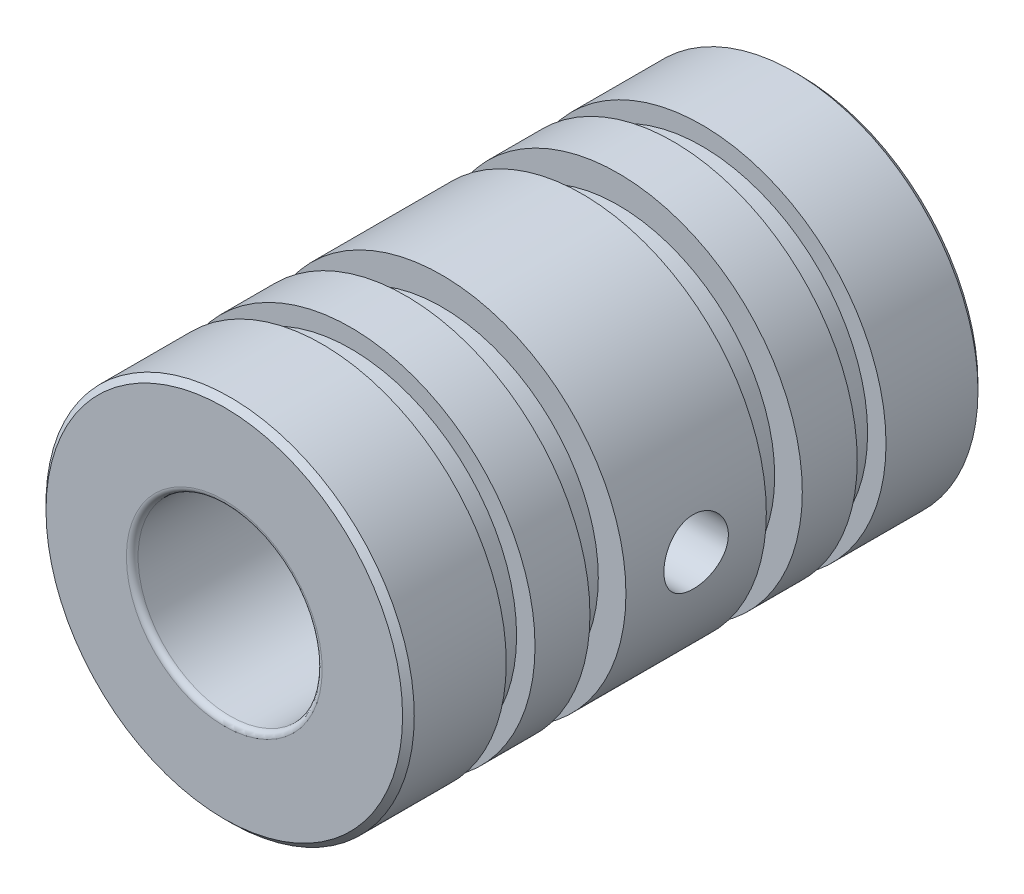
from build123d import *

# Parameters (mm, degrees)
BORE_DEPTH           = 17.8597153
BORE_DEPTH_BACK      = 17.8597153
SKETCH2_R            = 4
RETAINING_HOLE_2_R   = 1.4
RETAINING_HOLE_DEPTH = 17.8597153
ID_FILLET_R          = 0.254
OD_CHAMFER_SIZE      = 0.254
O_RINGS_2_W          = 1.5625
O_RINGS_2_H          = 1.2


with BuildPart() as part:
    # Sketch1 → Bearing (revolve)
    with BuildSketch(Plane(origin=(0, 0, 0), x_dir=(0, 0, -1), z_dir=(1, 0, 0))):
        Polygon((-12.5, 0), (12.5, 0), (12.5, -8), (8.25, -8), (8.25, -7.2), (7, -7.2), (7, -8), (-7, -8), (-7, -7.2), (-8.25, -7.2), (-8.25, -8), (-12.5, -8), align=None)
    revolve(axis=Axis((0, 0, 12.5), (0, 0, -1)))

    # Sketch2 → Bore (cut, two sides: drawn at the far end of the back side and taken through both)
    with BuildSketch(Plane.XY.offset(-BORE_DEPTH_BACK)):
        Circle(SKETCH2_R)
    extrude(amount=BORE_DEPTH + BORE_DEPTH_BACK, mode=Mode.SUBTRACT)

    # Retaining Hole 2 → Retaining Hole (cut, through all)
    with BuildSketch(Plane(origin=(0, 0, 0), x_dir=(0, 0, -1), z_dir=(1, 0, 0))):
        Circle(RETAINING_HOLE_2_R)
    extrude(amount=RETAINING_HOLE_DEPTH, mode=Mode.SUBTRACT)

    # ID Fillet
    id_fillet_edges = [part.edges().sort_by_distance(p)[0] for p in [
        (-4, 0, -12.5),
        (-4, 0, 12.5),
    ]]
    fillet(id_fillet_edges, radius=ID_FILLET_R)

    # OD Chamfer
    od_chamfer_edges = [part.edges().sort_by_distance(p)[0] for p in [
        (0, 8, -12.5),
        (0, 8, 12.5),
    ]]
    chamfer(od_chamfer_edges, length=OD_CHAMFER_SIZE)

    # O-Rings 2 → O-Rings (revolve, cut)
    with BuildSketch(Plane(origin=(0, 0, 0), x_dir=(0, 0, -1), z_dir=(1, 0, 0))):
        with Locations((-3.83125, -7.4)):
            Rectangle(O_RINGS_2_W, O_RINGS_2_H)
        with Locations((3.83125, -7.4)):
            Rectangle(O_RINGS_2_W, O_RINGS_2_H)
    revolve(axis=Axis((0, 0, 12.5), (0, 0, -1)), mode=Mode.SUBTRACT)


solid = part.part
